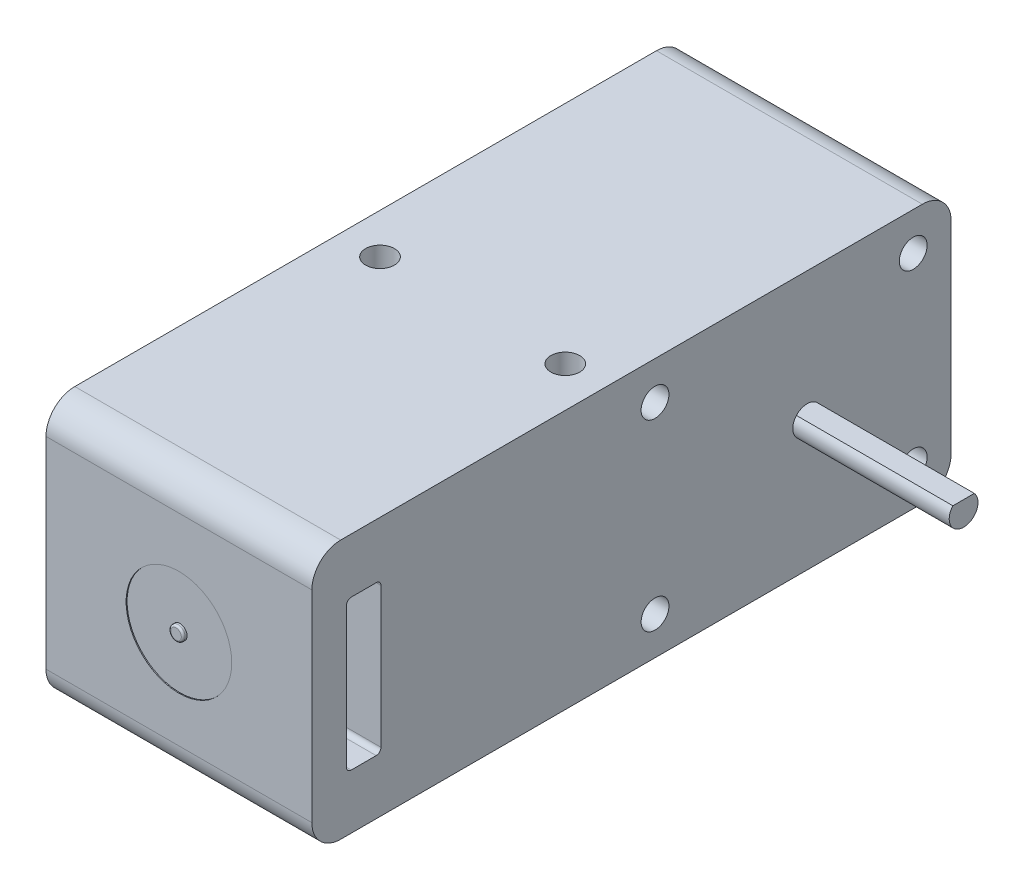
from build123d import *

# Parameters (mm, degrees)
SKETCH1_W           = 66.6
SKETCH1_H           = 27
SKETCH1_R           = 1.5
SKETCH1_W_2         = 3.6
SKETCH1_H_2         = 15.6
SKETCH1_R_2         = 1.45
BOSS_EXTRUDE1_DEPTH = 27.7
FILLET1_R           = 3
FILLET2_R           = 0.5
SKETCH2_R           = 1.5
CUT_EXTRUDE1_DEPTH  = 27.7
BOSS_EXTRUDE2_DEPTH = 10.6
BOSS_EXTRUDE3_DEPTH = 44
SKETCH4_R           = 7.25
BOSS_EXTRUDE4_DEPTH = 19
SKETCH5_R           = 5.5
CUT_EXTRUDE2_DEPTH  = 0.1
SKETCH6_R           = 0.75
BOSS_EXTRUDE6_DEPTH = 0.4
FILLET3_R           = 0.2


with BuildPart() as part:
    # Sketch1 → Boss-Extrude1 (new body)
    with BuildSketch(Plane(origin=(0, 0, 0), x_dir=(0, 0, -1), z_dir=(1, 0, 0))):
        with Locations((-9.403654485, -4.271617427)):
            Rectangle(SKETCH1_W, SKETCH1_H)
        with Locations((8.896345515, -4.271617427)):
            Circle(SKETCH1_R, mode=Mode.SUBTRACT)
        with Locations((-37.303654485, -4.271617427)):
            Rectangle(SKETCH1_W_2, SKETCH1_H_2, mode=Mode.SUBTRACT)
        with Locations((-6.953654485, 5.278382573)):
            Circle(SKETCH1_R_2, mode=Mode.SUBTRACT)
        with Locations((19.946345515, 5.278382573)):
            Circle(SKETCH1_R_2, mode=Mode.SUBTRACT)
        with Locations((-6.953654485, -13.821617427)):
            Circle(SKETCH1_R_2, mode=Mode.SUBTRACT)
        with Locations((19.946345515, -13.821617427)):
            Circle(SKETCH1_R_2, mode=Mode.SUBTRACT)
    extrude(amount=BOSS_EXTRUDE1_DEPTH)

    # Fillet1
    fillet1_edges = [part.edges().sort_by_distance(p)[0] for p in [
        (13.85, -17.771617427, -23.896345515),
        (13.85, -17.771617427, 42.703654485),
        (13.85, 9.228382573, -23.896345515),
        (13.85, 9.228382573, 42.703654485),
    ]]
    fillet(fillet1_edges, radius=FILLET1_R)

    # Fillet2
    fillet2_edges = [part.edges().sort_by_distance(p)[0] for p in [
        (13.85, -12.071617427, 35.503654485),
        (13.85, -12.071617427, 39.103654485),
        (13.85, 3.528382573, 39.103654485),
        (13.85, 3.528382573, 35.503654485),
    ]]
    fillet(fillet2_edges, radius=FILLET2_R)

    # Sketch2 → Cut-Extrude1 (cut)
    with BuildSketch(Plane(origin=(0, 9.228382573, 0), x_dir=(1, 0, 0), z_dir=(0, 1, 0))):
        with Locations((4.2, -12.103654485)):
            Circle(SKETCH2_R)
        with Locations((23.5, -12.103654485)):
            Circle(SKETCH2_R)
    extrude(amount=-CUT_EXTRUDE1_DEPTH, mode=Mode.SUBTRACT)



with BuildPart() as body_2:
    # Sketch3 → Boss-Extrude2 (new body)
    with BuildSketch(Plane(origin=(0, 0, 0), x_dir=(0, 0, -1), z_dir=(1, 0, 0))):
        with BuildLine():
            Line((10.014379504, -3.271617427), (7.778311526, -3.271617427))
            ThreePointArc((7.778311526, -3.271617427), (8.36111238, -5.672875965), (10.396345515, -4.271617427))
            ThreePointArc((10.396345515, -4.271617427), (10.297604053, -3.736384292), (10.014379504, -3.271617427))
        make_face()
    extrude(amount=-BOSS_EXTRUDE2_DEPTH)


with BuildPart() as part_1:
    add(part.part)

    add(body_2.part)  # Boss-Extrude3 merges body 2
    # Sketch3<4> → Boss-Extrude3 (add)
    with BuildSketch(Plane(origin=(0, 0, 0), x_dir=(0, 0, -1), z_dir=(1, 0, 0))):
        with BuildLine():
            Line((10.014379504, -3.271617427), (7.778311526, -3.271617427))
            ThreePointArc((7.778311526, -3.271617427), (8.36111238, -5.672875965), (10.396345515, -4.271617427))
            ThreePointArc((10.396345515, -4.271617427), (10.297604053, -3.736384292), (10.014379504, -3.271617427))
        make_face()
    extrude(amount=BOSS_EXTRUDE3_DEPTH)

    # Sketch4 → Boss-Extrude4 (add)
    with BuildSketch(Plane(origin=(0, 0, 39.103654485), x_dir=(-1, 0, 0), z_dir=(0, 0, -1))):
        with Locations((-13.85, -4.271617427)):
            Circle(SKETCH4_R)
    extrude(amount=BOSS_EXTRUDE4_DEPTH)

    # Sketch5 → Cut-Extrude2 (cut)
    with BuildSketch(Plane.XY.offset(42.703654485)):
        with Locations((13.85, -4.521617427)):
            Circle(SKETCH5_R)
    extrude(amount=-CUT_EXTRUDE2_DEPTH, mode=Mode.SUBTRACT)

    # Sketch6 → Boss-Extrude6 (add)
    with BuildSketch(Plane.XY.offset(42.603654485)):
        with Locations((13.85, -4.521617427)):
            Circle(SKETCH6_R)
    extrude(amount=BOSS_EXTRUDE6_DEPTH)

    # Fillet3
    fillet3_edges = [part_1.edges().sort_by_distance(p)[0] for p in [
        (13.1, -4.521617427, 43.003654485),
    ]]
    fillet(fillet3_edges, radius=FILLET3_R)


solid = part_1.part
